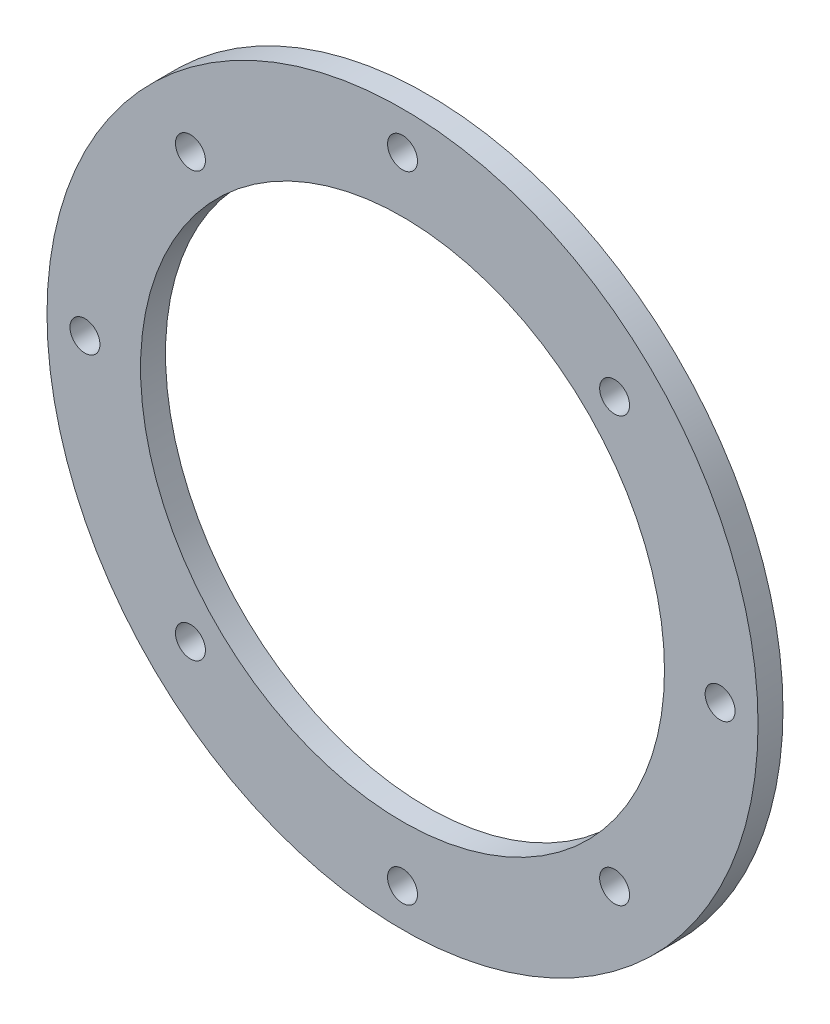
from build123d import *

# Parameters (mm, degrees)
SKETCH_1_R          = 28.5
SKETCH_1_R_2        = 21
EXTRUDE_1_DEPTH     = 2
SKETCH_2_R          = 1.2
CUT_EXTRUDE_1_DEPTH = 41.354677548
HOLE_WIZARD_M2_1_D  = 2.4


with BuildPart() as part:
    # 스케치1 → 보스-돌출1 (new body)
    with BuildSketch(Plane.XY):
        Circle(SKETCH_1_R)
        Circle(SKETCH_1_R_2, mode=Mode.SUBTRACT)
    extrude(amount=EXTRUDE_1_DEPTH)

    # 스케치2 → 컷-돌출1 (cut, through all)
    with BuildSketch(Plane.XY):
        with Locations((0, 25.455844123)):
            Circle(SKETCH_2_R)
        with Locations((25.455844123, 0)):
            Circle(SKETCH_2_R)
        with Locations((-25.455844123, 0)):
            Circle(SKETCH_2_R)
        with Locations((0, -25.455844123)):
            Circle(SKETCH_2_R)
    extrude(amount=CUT_EXTRUDE_1_DEPTH, mode=Mode.SUBTRACT)

    # M2 여유 구멍1 (through all)
    with Locations(Plane(origin=(-17, 17, 2), x_dir=(1, 0, 0), z_dir=(0, 0, 1))):
        with Locations((0, 0), (34, 0), (34, -34), (0, -34)):
            Hole(HOLE_WIZARD_M2_1_D / 2)


solid = part.part
